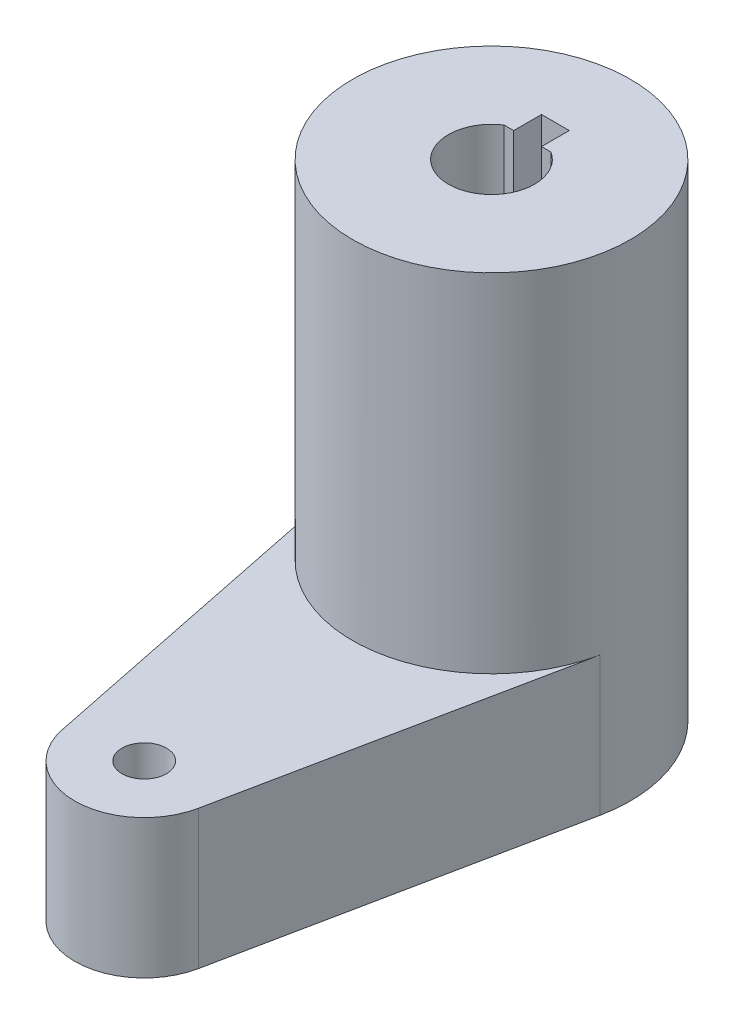
from build123d import *

# Parameters (mm, degrees)
SKETCH_1_R               = 1.6
EXTRUDE_1_DEPTH          = 10
SKETCH_3_R               = 10
EXTRUDE_2_DEPTH          = 25
CUT_EXTRUDE_1_DEPTH      = 41.311288741
CUT_EXTRUDE_1_DEPTH_BACK = 41.311288741
CUT_EXTRUDE_2_DEPTH      = 25


with BuildPart() as part:
    # ｽｹｯﾁ1 → ﾎﾞｽ - 押し出し1 (new body)
    with BuildSketch(Plane(origin=(0, 0, 0), x_dir=(1, 0, 0), z_dir=(0, 1, 0))):
        with BuildLine():
            Line((-9.797958971, -2), (-4.898979486, -26))
            ThreePointArc((-4.898979486, -26), (0, -30), (4.898979486, -26))
            Line((4.898979486, -26), (9.797958971, -2))
            ThreePointArc((9.797958971, -2), (0, 10), (-9.797958971, -2))
        make_face()
        with Locations(Location((0, -25, 0), (0, 0, 270))):
            Circle(SKETCH_1_R, mode=Mode.SUBTRACT)
    extrude(amount=EXTRUDE_1_DEPTH)

    # ｽｹｯﾁ3 → ﾎﾞｽ - 押し出し2 (add)
    with BuildSketch(Plane(origin=(0, 10, 0), x_dir=(1, 0, 0), z_dir=(0, 1, 0))):
        with Locations(Location((0, 0, 0), (0, 0, 191.536959033))):
            Circle(SKETCH_3_R)
    extrude(amount=EXTRUDE_2_DEPTH)

    # ｽｹｯﾁ2 → ｶｯﾄ - 押し出し1 (cut, two sides: drawn at the far end of the back side and taken through both)
    with BuildSketch(Plane(origin=(0, 10, 0), x_dir=(1, 0, 0), z_dir=(0, 1, 0)).offset(-CUT_EXTRUDE_1_DEPTH_BACK)):
        with BuildLine():
            Line((-1.688194302, 2.6), (-1, 2.6))
            Line((-1, 2.6), (-1, 4.6))
            Line((-1, 4.6), (1, 4.6))
            Line((1, 4.6), (1, 2.6))
            Line((1, 2.6), (1.688194302, 2.6))
            ThreePointArc((1.688194302, 2.6), (0, -3.1), (-1.688194302, 2.6))
        make_face()
    extrude(amount=CUT_EXTRUDE_1_DEPTH + CUT_EXTRUDE_1_DEPTH_BACK, mode=Mode.SUBTRACT)

    # ｽｹｯﾁ4 → ｶｯﾄ - 押し出し2 (cut)
    with BuildSketch(Plane(origin=(0, 0, 0), x_dir=(-1, 0, 0), z_dir=(0, -1, 0))):
        with BuildLine():
            Line((-4.226182617, 9.06307787), (0, 0))
            Line((0, 0), (4.226182617, 9.06307787))
            ThreePointArc((4.226182617, 9.06307787), (0, 10), (-4.226182617, 9.06307787))
        make_face()
    extrude(amount=-CUT_EXTRUDE_2_DEPTH, mode=Mode.SUBTRACT)


solid = part.part
